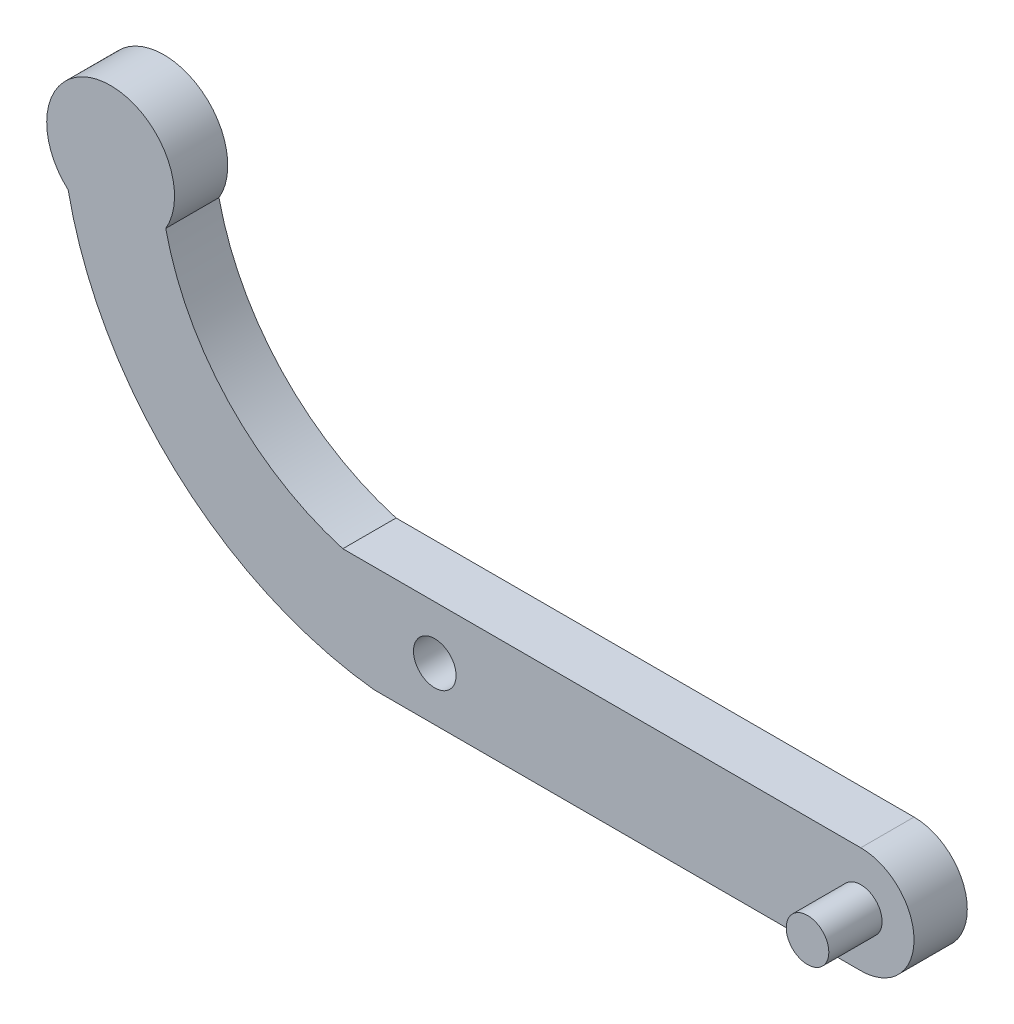
from build123d import *

# Parameters (mm, degrees)
CROQUIS1_R              = 2
SALIENTE_EXTRUIR1_DEPTH = 5
CROQUIS2_R              = 2
SALIENTE_EXTRUIR2_DEPTH = 5


with BuildPart() as part:
    # Croquis1 → Saliente-Extruir1 (new body)
    with BuildSketch(Plane.XY):
        with BuildLine():
            Line((-25.953664325, 5.804713338), (22.678050908, 5.804713338))
            ThreePointArc((22.678050908, 5.804713338), (27.678050908, 0.804713338), (22.678050908, -4.195286662))
            Line((22.678050908, -4.195286662), (-23.047151147, -4.195286662))
            ThreePointArc((-23.047151147, -4.195286662), (-41.661617991, 4.287687085), (-51.741257509, 22.088251307))
            ThreePointArc((-51.741257509, 22.088251307), (-48.695784379, 32.499543684), (-42.578743977, 23.541210565))
            ThreePointArc((-42.578743977, 23.541210565), (-36.695300038, 12.396079877), (-25.953664325, 5.804713338))
        make_face()
        with Locations((-17.321949092, 0.804713338)):
            Circle(CROQUIS1_R, mode=Mode.SUBTRACT)
    extrude(amount=SALIENTE_EXTRUIR1_DEPTH)

    # Croquis2 → Saliente-Extruir2 (add)
    with BuildSketch(Plane.XY.offset(5)):
        with Locations((22.678050908, 0.804713338)):
            Circle(CROQUIS2_R)
    extrude(amount=SALIENTE_EXTRUIR2_DEPTH)


solid = part.part
